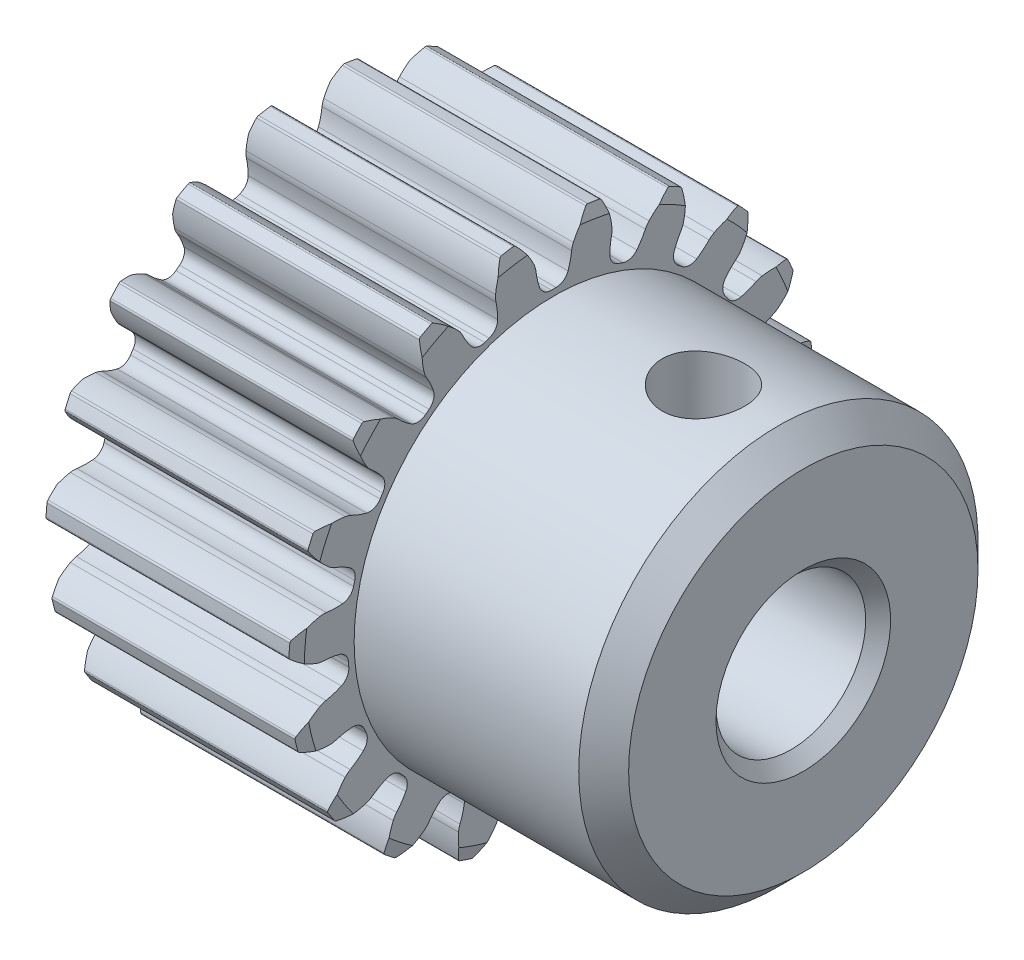
from build123d import *

# Parameters (mm, degrees)
CHAMFER1_SIZE       = 1
CHAMFER2_SIZE       = 0.5
CUT_EXTRUDE1_DEPTH  = 25.909837414
CIRPATTERN1_COUNT   = 19
TAPPED_HOLE1_REACH  = 37.558
TAPPED_HOLE1_BORE_R = 1.65


with BuildPart() as part:
    # Sketch1 → Revolve1 (revolve)
    with BuildSketch(Plane.XY, mode=Mode.PRIVATE) as revolve1_sk:
        Polygon((0, 3), (0, 10), (0.133974596, 10.5), (9.866025404, 10.5), (10, 10), (10, 8), (20, 8), (20, 3), align=None)
    revolve(revolve1_sk.sketch.rotate(Axis((0, 0, 0), (1, 0, 0)), 90), axis=Axis((0, 0, 0), (1, 0, 0)))

    # Chamfer1
    chamfer1_edges = [part.edges().sort_by_distance(p)[0] for p in [
        (20, 0, -8),
    ]]
    chamfer(chamfer1_edges, length=CHAMFER1_SIZE)

    # Chamfer2
    chamfer2_edges = [part.edges().sort_by_distance(p)[0] for p in [
        (20, 0, -3),
        (0, 0, -3),
    ]]
    chamfer(chamfer2_edges, length=CHAMFER2_SIZE)

    # Sketch2 → Cut-Extrude1 (cut, through all)
    with BuildSketch(Plane(origin=(0, 0, 0), x_dir=(0, 0, -1), z_dir=(1, 0, 0))):
        with BuildLine():
            ThreePointArc((1.404821067, 10.364902415), (1.055730488, 9.943140304), (0.784503782, 9.467552684))
            ThreePointArc((0.784503782, 9.467552684), (0.739784174, 9.345752513), (0.715006015, 9.218390165))
            ThreePointArc((0.715006015, 9.218390165), (0.660639907, 8.897728035), (0.570986888, 8.585090526))
            ThreePointArc((0.570986888, 8.585090526), (0.386141263, 8.340275096), (0.093126367, 8.249474376))
            ThreePointArc((0.093126367, 8.249474376), (0, 8.25), (-0.093126367, 8.249474376))
            ThreePointArc((-0.093126367, 8.249474376), (-0.386141263, 8.340275096), (-0.570986888, 8.585090526))
            ThreePointArc((-0.570986888, 8.585090526), (-0.660639907, 8.897728035), (-0.715006015, 9.218390165))
            ThreePointArc((-0.715006015, 9.218390165), (-0.739784174, 9.345752513), (-0.784503782, 9.467552684))
            ThreePointArc((-0.784503782, 9.467552684), (-1.055730488, 9.943140304), (-1.404821067, 10.364902415))
            ThreePointArc((-1.404821067, 10.364902415), (-1.444104725, 10.389478126), (-1.490248876, 10.39370763))
            ThreePointArc((-1.490248876, 10.39370763), (0, 10.5), (1.490248876, 10.39370763))
            ThreePointArc((1.490248876, 10.39370763), (1.444104725, 10.389478126), (1.404821067, 10.364902415))
        make_face()
    cut_extrude1 = extrude(amount=CUT_EXTRUDE1_DEPTH, mode=Mode.SUBTRACT)

    # CirPattern1: Cut-Extrude1 ×19 about axis
    cirpattern1_axis = Axis((0, 0, 0), (1, 0, 0))
    for i in range(1, CIRPATTERN1_COUNT):
        add(cut_extrude1.rotate(cirpattern1_axis, i * 360 / CIRPATTERN1_COUNT), mode=Mode.SUBTRACT)

    # Tapped Hole1 bore → Tapped Hole1 (cut, up to next)
    with BuildSketch(Plane(origin=(-8.5, 8, 0), x_dir=(1, 0, 0), z_dir=(0, 1, 0)), mode=Mode.PRIVATE) as tapped_hole1_sk1:
        with Locations((24.5, 0)):
            Circle(TAPPED_HOLE1_BORE_R)
    tapped_hole1_tool1 = extrude(tapped_hole1_sk1.sketch, amount=-TAPPED_HOLE1_REACH, mode=Mode.PRIVATE) & part.part
    add(tapped_hole1_tool1.solids().sort_by_distance((16, 8, 0))[0], mode=Mode.SUBTRACT)


solid = part.part
